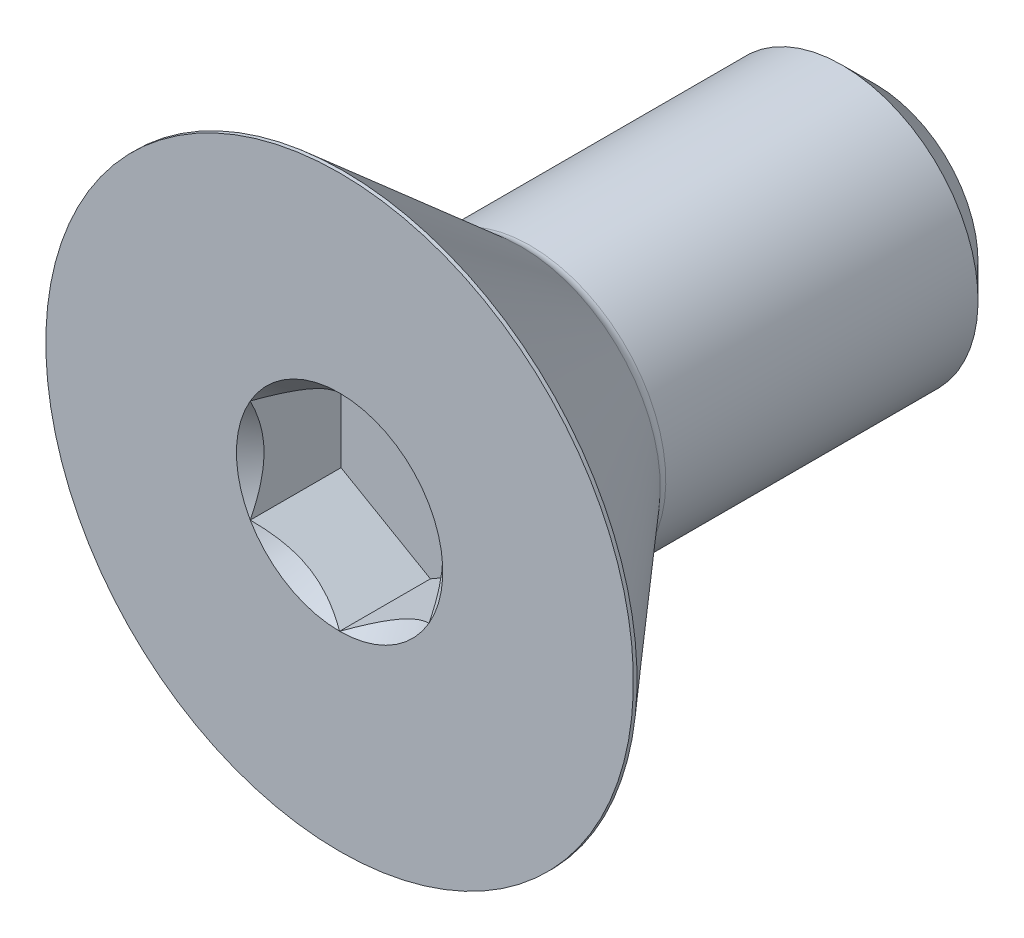
from build123d import *

# Parameters (mm, degrees)
SKETCH10_R         = 1.833087105
CUT_EXTRUDE2_DEPTH = 1.6129
CUT_EXTRUDE2_DRAFT = -45
CUT_EXTRUDE1_DEPTH = 1.6129


with BuildPart() as part:
    # Sketch2 → Revolve1 (revolve)
    with BuildSketch(Plane(origin=(0, 0, 0), x_dir=(0, 0, -1), z_dir=(1, 0, 0))):
        with BuildLine():
            Line((-4.697984, 5.2197), (-1.5367, 2.471637744))
            ThreePointArc((-1.5367, 2.471637744), (-1.46358483, 2.428138789), (-1.379866229, 2.413))
            Line((-1.379866229, 2.413), (4.1671875, 2.413))
            Line((4.1671875, 2.413), (4.7625, 1.8176875))
            Line((4.7625, 1.8176875), (4.7625, 0))
            Line((4.7625, 0), (-4.7625, 0))
            Line((-4.7625, 0), (-4.7625, 5.2197))
            Line((-4.7625, 5.2197), (-4.697984, 5.2197))
        make_face()
    revolve(axis=Axis((0, 0, -4.7625), (0, 0, 1)))


with BuildPart() as cut_extrude2_tool:
    # Sketch10 → Cut-Extrude2 (with draft: the straight prism first)
    with BuildSketch(Plane.XY.offset(4.7625)):
        Circle(SKETCH10_R)
    extrude(amount=-CUT_EXTRUDE2_DEPTH)
    # Cut-Extrude2: the draft: its side faces are tilted about the plane it starts from
    cut_extrude2_sides = [cut_extrude2_tool.faces().sort_by_distance(p)[0] for p in [
        (-1.833087105, 0, 3.95605),
    ]]
    draft(cut_extrude2_sides, Plane.XY.offset(4.7625), CUT_EXTRUDE2_DRAFT)


with BuildPart() as part_1:
    add(part.part)

    # Cut-Extrude2: cut by cut_extrude2_tool
    add(cut_extrude2_tool.part, mode=Mode.SUBTRACT)

    # Sketch9 → Cut-Extrude1 (cut)
    with BuildSketch(Plane.XY.offset(4.7625)):
        Polygon((1.5875, -0.916543552), (1.5875, 0.916543552), (0, 1.833087105), (-1.5875, 0.916543552), (-1.5875, -0.916543552), (0, -1.833087105), align=None)
    extrude(amount=-CUT_EXTRUDE1_DEPTH, mode=Mode.SUBTRACT)


solid = part_1.part
